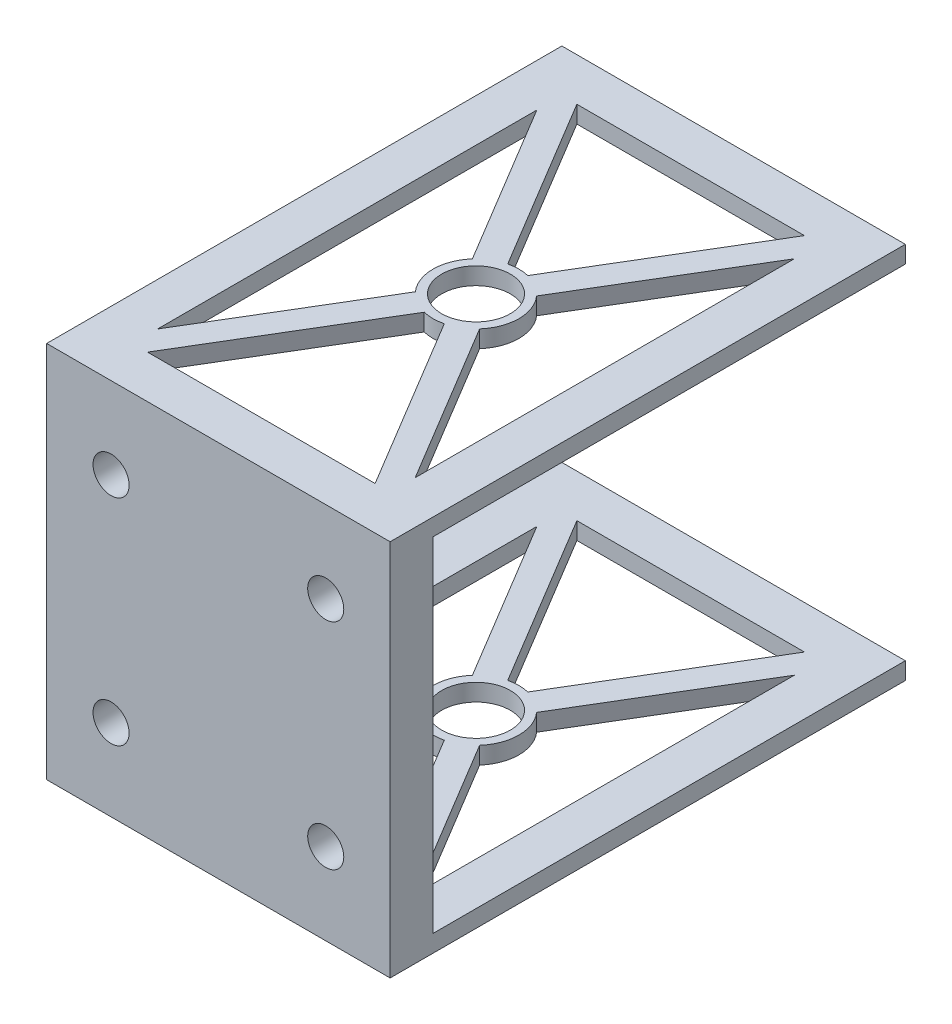
from build123d import *

# Parameters (mm, degrees)
SKETCH_2_W               = 40
SKETCH_2_H               = 40
EXTRUDE_1_DEPTH          = 5
EXTRUDE_2_DEPTH          = 2
HOLE_WIZARD_M5_1_D       = 4.2
HOLE_WIZARD_M5_1_DEPTH   = 12.4
HOLE_WIZARD_M5_1_TIP     = 1.2618073
CUT_EXTRUDE_5_DEPTH      = 74.218850032
CUT_EXTRUDE_5_DEPTH_BACK = 74.218850032
SKETCH_4_R               = 4


with BuildPart() as part:
    # 草图2 → 凸台-拉伸1 (new body)
    with BuildSketch(Plane.XY):
        Rectangle(SKETCH_2_W, SKETCH_2_H)
    extrude(amount=EXTRUDE_1_DEPTH)

    # 草图3 → 凸台-拉伸2 (add)
    with BuildSketch(Plane(origin=(0, 20, 0), x_dir=(1, 0, 0), z_dir=(0, 1, 0))):
        Polygon((20, 0), (20, 55), (-20, 55), (-20, 0), (-20, -5), (20, -5), align=None)
    extrude_2 = extrude(amount=EXTRUDE_2_DEPTH)

    # 镜向1: 凸台-拉伸2 across plane
    add(extrude_2.mirror(Plane.ZX))

    # M5 螺纹孔1
    with Locations(Plane(origin=(-12.5, 12.5, 5), x_dir=(1, 0, 0), z_dir=(0, 0, 1))):
        with Locations((0, 0), (25, 0), (25, -25), (0, -25)):
            Hole(HOLE_WIZARD_M5_1_D / 2, depth=HOLE_WIZARD_M5_1_DEPTH)
            with Locations((0, 0, -(HOLE_WIZARD_M5_1_DEPTH + HOLE_WIZARD_M5_1_TIP / 2))):  # 118° drill point
                Cone(0, HOLE_WIZARD_M5_1_D / 2, HOLE_WIZARD_M5_1_TIP, mode=Mode.SUBTRACT)

    # 草图4 → 切除-拉伸5 (cut, two sides: drawn at the far end of the back side and taken through both)
    with BuildSketch(Plane(origin=(0, -22, 0), x_dir=(1, 0, 0), z_dir=(0, 1, 0)).offset(-CUT_EXTRUDE_5_DEPTH_BACK)):
        with BuildLine():
            Line((13.250714432, 50), (-13.250714432, 50))
            Line((-13.250714432, 50), (-1.167748962, 29.861724217))
            ThreePointArc((-1.167748962, 29.861724217), (0, 30), (1.167748962, 29.861724217))
            Line((1.167748962, 29.861724217), (13.250714432, 50))
        make_face()
        with BuildLine():
            Line((15, 2.915475947), (15, 47.084524053))
            Line((15, 47.084524053), (3.740227739, 28.318236951))
            ThreePointArc((3.740227739, 28.318236951), (4.674459257, 26.774663532), (5, 25))
            ThreePointArc((5, 25), (4.674459257, 23.225336468), (3.740227739, 21.681763049))
            Line((3.740227739, 21.681763049), (15, 2.915475947))
        make_face()
        with BuildLine():
            Line((-3.740227739, 28.318236951), (-15, 47.084524053))
            Line((-15, 47.084524053), (-15, 2.915475947))
            Line((-15, 2.915475947), (-3.740227739, 21.681763049))
            ThreePointArc((-3.740227739, 21.681763049), (-5, 25), (-3.740227739, 28.318236951))
        make_face()
        with BuildLine():
            Line((-1.167748962, 20.138275783), (-13.250714432, 0))
            Line((-13.250714432, 0), (13.250714432, 0))
            Line((13.250714432, 0), (1.167748962, 20.138275783))
            ThreePointArc((1.167748962, 20.138275783), (0, 20), (-1.167748962, 20.138275783))
        make_face()
        with Locations(Location((0, 25, 0), (0, 0, 270))):
            Circle(SKETCH_4_R)
    extrude(amount=CUT_EXTRUDE_5_DEPTH + CUT_EXTRUDE_5_DEPTH_BACK, mode=Mode.SUBTRACT)


solid = part.part
